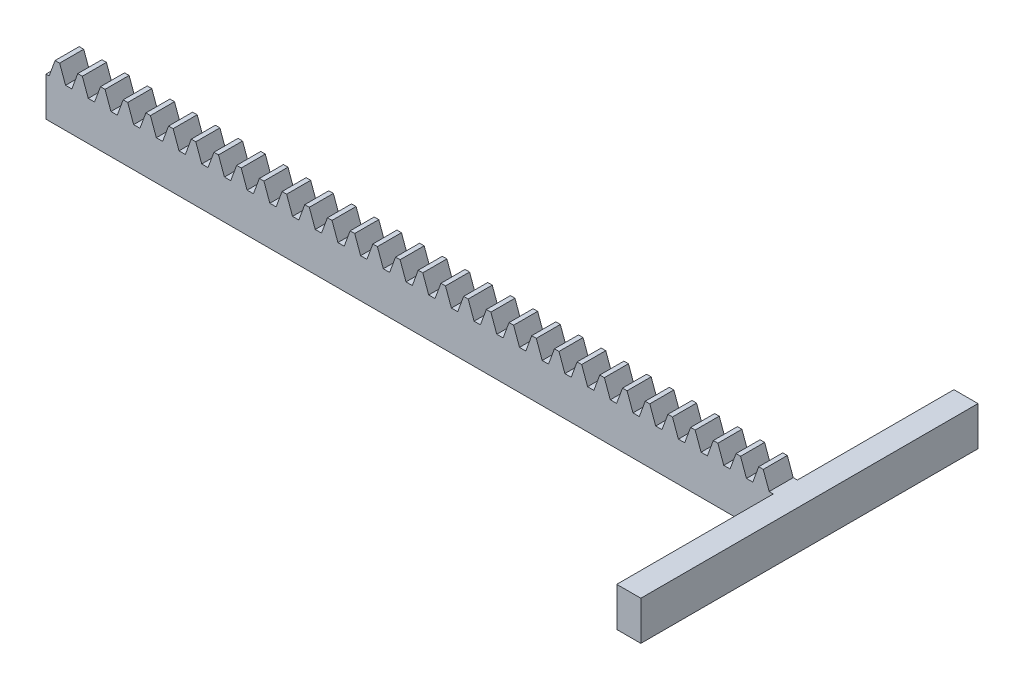
from build123d import *

# Parameters (mm, degrees)
BLANKSKE_W              = 151
BLANKSKE_H              = 11.5
BLANK_DEPTH             = 5
TOOTHCUTSIM_DEPTH       = 152.519800686
TEETHCUTS_COUNT         = 33
TEETHCUTS_PITCH         = 4.712388975
CROQUIS1_W              = 70
CROQUIS1_H              = 8.125
SALIENTE_EXTRUIR1_DEPTH = 5


with BuildPart() as part:
    # BlankSke → Blank (new body)
    with BuildSketch(Plane.XY):
        with Locations((75.5, 5.75)):
            Rectangle(BLANKSKE_W, BLANKSKE_H)
    extrude(amount=-BLANK_DEPTH)

    # TooCutSkeSim → ToothCutSim (cut, through all)
    with BuildSketch(Plane.XY):
        Polygon((0.654653055, 8.125), (-0.654653055, 8.125), (-1.892297439, 11.5254), (1.892297439, 11.5254), align=None)
    toothcutsim = extrude(amount=-TOOTHCUTSIM_DEPTH, mode=Mode.SUBTRACT)

    # TeethCuts: ToothCutSim ×33
    with Locations(*[(i * TEETHCUTS_PITCH, 0, 0) for i in range(1, TEETHCUTS_COUNT)]):
        add(toothcutsim, mode=Mode.SUBTRACT)

    # Croquis1 → Saliente-Extruir1 (add)
    with BuildSketch(Plane(origin=(151, 0, 0), x_dir=(0, 0, -1), z_dir=(1, 0, 0))):
        with Locations((2.5, 4.0625)):
            Rectangle(CROQUIS1_W, CROQUIS1_H)
    extrude(amount=SALIENTE_EXTRUIR1_DEPTH)


solid = part.part
